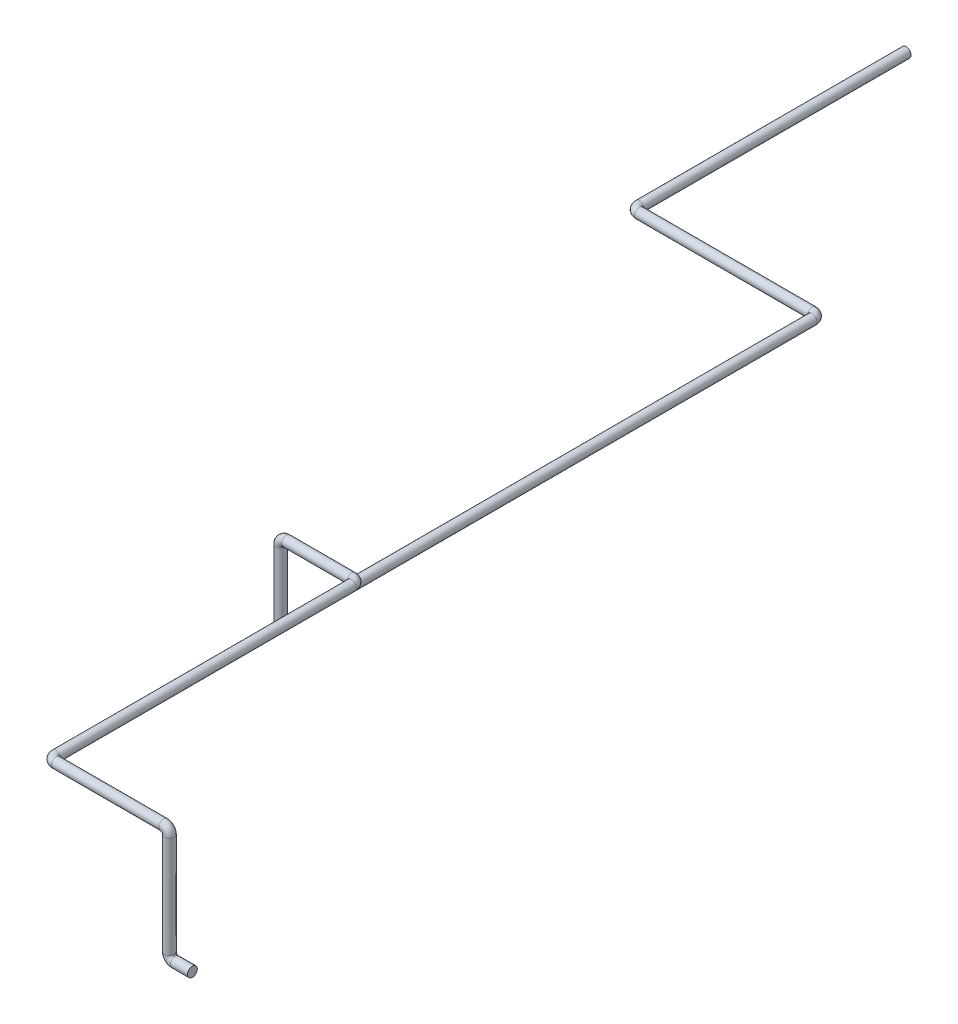
from build123d import *

# Parameters (mm, degrees)
CROQUIS1_R              = 12.7
SALIENTE_EXTRUIR1_DEPTH = 10
CROQUIS2_R              = 12.7
CROQUIS3_W              = 0.092547174
CROQUIS3_H              = 0.049722896
SALIENTE_EXTRUIR2_DEPTH = 1


with BuildPart() as part:
    # Croquis1 → Saliente-Extruir1 (new body)
    with BuildSketch(Plane.XY):
        Circle(CROQUIS1_R)
    extrude(amount=SALIENTE_EXTRUIR1_DEPTH)

    # Barrer1: sweep along a curve in space
    with BuildLine() as barrer1_path:
        Line((0, 0, 10), (0, 0, 695))
        ThreePointArc((0, 0, 695), (4.393398282, 0, 705.606601718), (15, 0, 710))
        Line((15, 0, 710), (465, 0, 710))
        ThreePointArc((465, 0, 710), (475.606601718, 0, 714.393398282), (480, 0, 725))
        Line((480, 0, 725), (480, 0, 2095))
        ThreePointArc((480, 0, 2095), (480, 4.393398282, 2105.606601718), (480, 15, 2110))
        Line((480, 15, 2110), (480, 185, 2110))
        ThreePointArc((480, 185, 2110), (484.393398282, 195.606601718, 2110), (495, 200, 2110))
        Line((495, 200, 2110), (665, 200, 2110))
        ThreePointArc((665, 200, 2110), (675.606601718, 200, 2114.393398282), (680, 200, 2125))
        Line((680, 200, 2125), (680, 200, 2895))
        ThreePointArc((680, 200, 2895), (684.393398282, 200, 2905.606601718), (695, 200, 2910))
        Line((695, 200, 2910), (975, 200, 2910))
        ThreePointArc((975, 200, 2910), (985.606601718, 195.606601718, 2910), (990, 185, 2910))
        Line((990, 185, 2910), (990, -80, 2910))
        ThreePointArc((990, -80, 2910), (994.393398282, -90.606601718, 2910), (1005, -95, 2910))
        Line((1005, -95, 2910), (1050, -95, 2910))
    # Croquis2 → Barrer1 (sweep)
    with BuildSketch(Plane.XY.offset(10)):
        Circle(CROQUIS2_R)
    sweep(path=barrer1_path.line)

    # Croquis3 → Saliente-Extruir2 (add)
    with BuildSketch(Plane(origin=(0, 0, 0), x_dir=(-1, 0, 0), z_dir=(0, 0, -1))):
        with Locations((0, 12.7)):
            Rectangle(CROQUIS3_W, CROQUIS3_H)
    extrude(amount=-SALIENTE_EXTRUIR2_DEPTH)


solid = part.part
